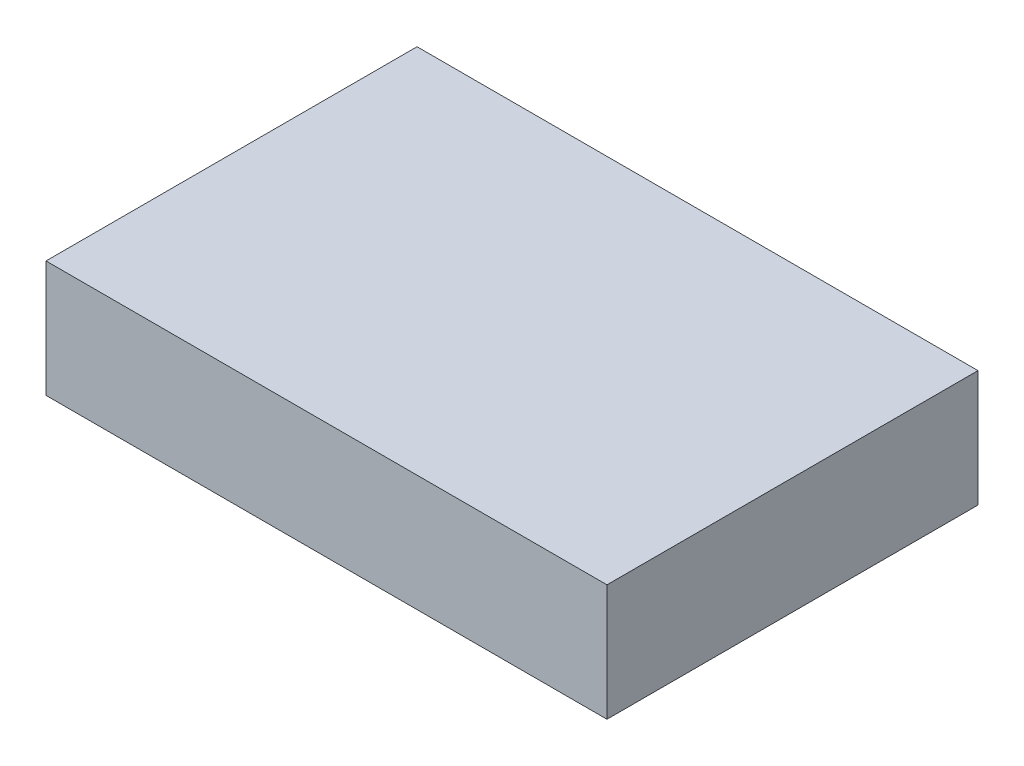
from build123d import *

# Parameters (mm, degrees)
SKETCH3_W      = 122.353921001
SKETCH3_H      = 80.929258312
EXTRUDE3_DEPTH = 25.4


with BuildPart() as part:
    # Sketch3 → Extrude3 (new body)
    with BuildSketch(Plane(origin=(0, 0, 0), x_dir=(1, 0, 0), z_dir=(0, 1, 0))):
        with Locations((61.176960501, 40.464629156)):
            Rectangle(SKETCH3_W, SKETCH3_H)
    extrude(amount=-EXTRUDE3_DEPTH)


solid = part.part
